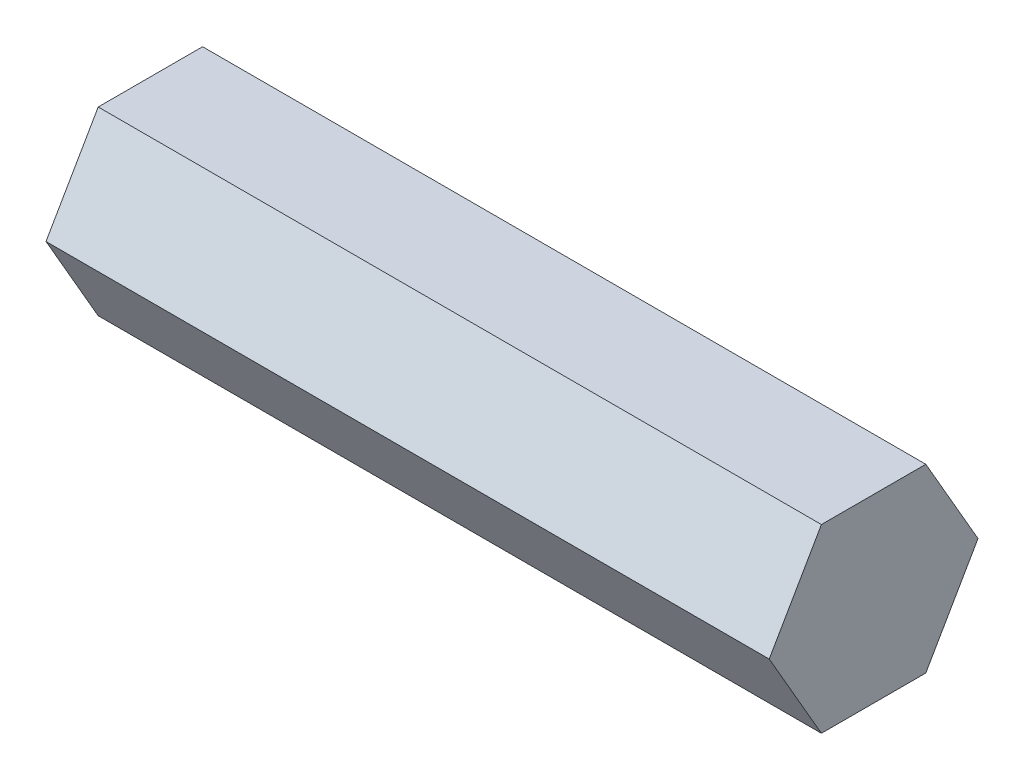
from build123d import *

# Parameters (mm, degrees)
BOSS_EXTRUDE1_DEPTH = 25.4
CUT_EXTRUDE1_DEPTH  = 12.7


with BuildPart() as part:
    # Sketch1 → Boss-Extrude1 (new, symmetric)
    with BuildSketch(Plane(origin=(0, 0, 0), x_dir=(0, 0, -1), z_dir=(1, 0, 0))):
        Polygon((7.332348419, 0), (3.666174209, 6.35), (-3.666174209, 6.35), (-7.332348419, 0), (-3.666174209, -6.35), (3.666174209, -6.35), align=None)
    extrude(amount=BOSS_EXTRUDE1_DEPTH, both=True)

    # Sketch2 → Cut-Extrude1 (cut)
    with BuildSketch(Plane.ZY.offset(25.4)):
        Polygon((3.464101579, 0), (1.73205079, 2.999999969), (-1.73205079, 2.999999969), (-3.464101579, 0), (-1.73205079, -2.999999969), (1.73205079, -2.999999969), align=None)
    extrude(amount=-CUT_EXTRUDE1_DEPTH, mode=Mode.SUBTRACT)


solid = part.part
